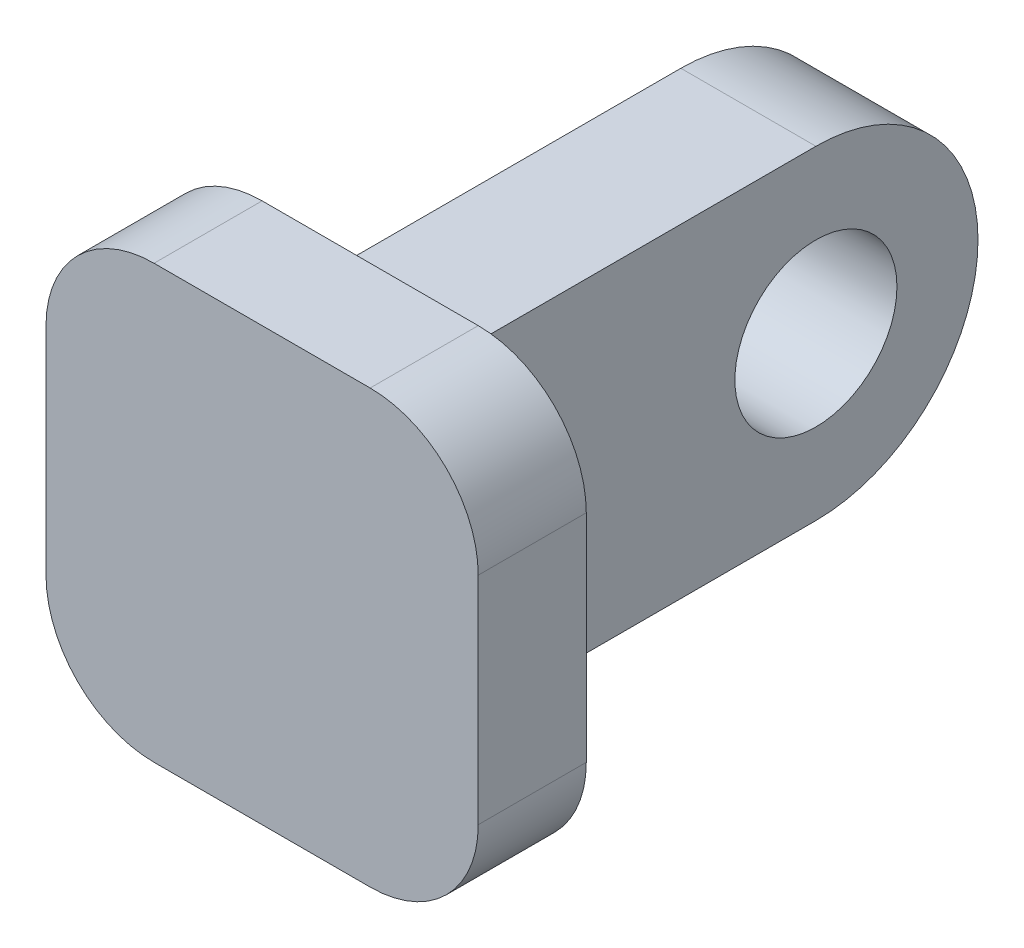
from build123d import *

# Parameters (mm, degrees)
SKETCH1_W               = 8
SKETCH1_H               = 8
BOSS_EXTRUDE1_DEPTH     = 1
FILLET1_R               = 2
BOSS_EXTRUDE2_DEPTH     = 1.25
CUT_EXTRUDE1_DEPTH      = 13.369316877
CUT_EXTRUDE1_DEPTH_BACK = 13.369316877
SKETCH3_R               = 1.5


with BuildPart() as part:
    # Sketch1 → Boss-Extrude1 (new, symmetric)
    with BuildSketch(Plane.XY):
        Rectangle(SKETCH1_W, SKETCH1_H)
    extrude(amount=BOSS_EXTRUDE1_DEPTH, both=True)

    # Fillet1
    fillet1_edges = [part.edges().sort_by_distance(p)[0] for p in [
        (-4, 4, 0),
        (4, 4, 0),
        (4, -4, 0),
        (-4, -4, 0),
    ]]
    fillet(fillet1_edges, radius=FILLET1_R)

    # Sketch2 → Boss-Extrude2 (add, symmetric)
    with BuildSketch(Plane(origin=(0, 0, 0), x_dir=(0, 0, -1), z_dir=(1, 0, 0))):
        with BuildLine():
            Line((1, 3), (8, 3))
            ThreePointArc((8, 3), (11, 0), (8, -3))
            Line((8, -3), (1, -3))
            Line((1, -3), (1, 3))
        make_face()
    extrude(amount=BOSS_EXTRUDE2_DEPTH, both=True)

    # Sketch3 → Cut-Extrude1 (cut, two sides: drawn at the far end of the back side and taken through both)
    with BuildSketch(Plane(origin=(0, 0, 0), x_dir=(0, 0, -1), z_dir=(1, 0, 0)).offset(-CUT_EXTRUDE1_DEPTH_BACK)):
        with Locations((8, 0)):
            Circle(SKETCH3_R)
    extrude(amount=CUT_EXTRUDE1_DEPTH + CUT_EXTRUDE1_DEPTH_BACK, mode=Mode.SUBTRACT)


solid = part.part
